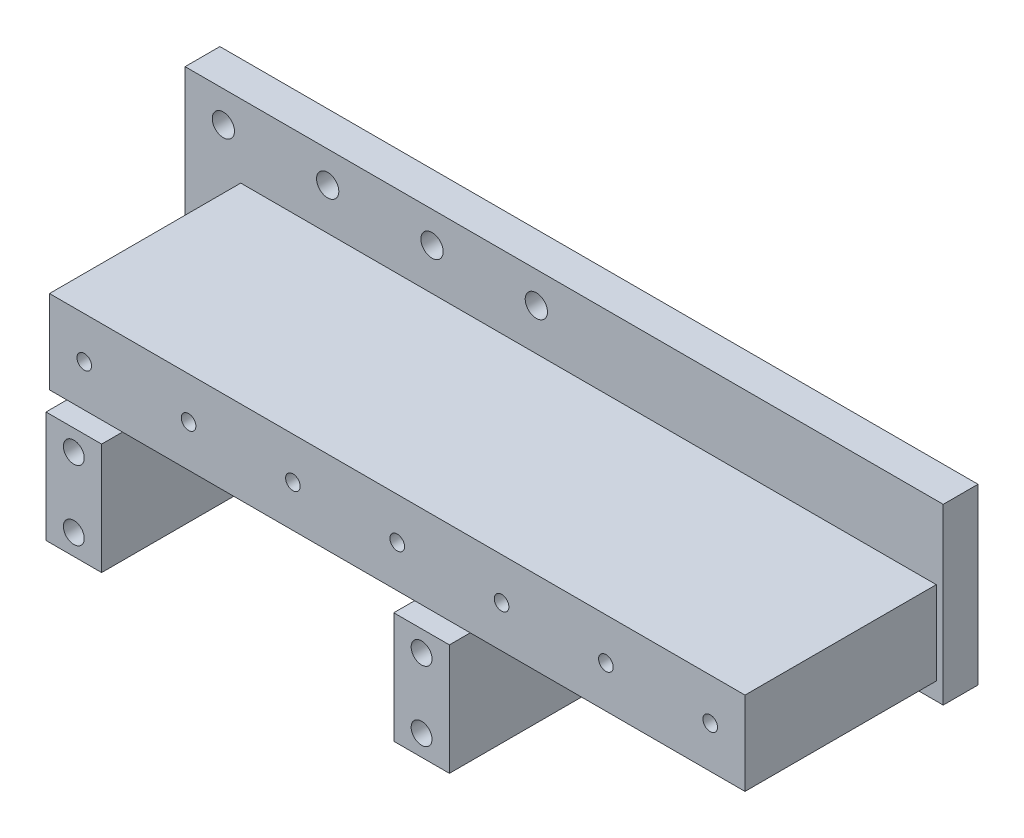
from build123d import *

# Parameters (mm, degrees)
BASE_START                = -5
BASE_PLATE_DEPTH          = 5
MOUNTING_START            = -5.1
MOUNTING_HOLES_PROFILE_R  = 1.6
MOUNTING_HOLES_DEPTH      = 5.3
RAIL_SUPPORT_PROFILE_W    = 100
RAIL_SUPPORT_PROFILE_H    = 12
RAIL_SUPPORT_DEPTH        = 27.5
RAIL_START                = 21
RAIL_FASTENERS_PROFILE_R  = 1.05
RAIL_FASTENERS_DEPTH      = 6.6
SERVO_SUPPORTS_PROFILE_W  = 8
SERVO_SUPPORTS_PROFILE_H  = 16
SERVO_SUPPORTS_DEPTH      = 26
SERVO_START               = 18
SERVO_FASTENERS_PROFILE_R = 1.5
SERVO_FASTENERS_DEPTH     = 8.1


with BuildPart() as part:
    # Base plate profile → Base plate (new body)
    with BuildSketch(Plane.XY.offset(BASE_START)):
        Polygon((-25, -15), (41, -15), (41, 10), (84, 10), (84, 35), (10, 35), (-10, 35), (-25, 35), align=None)
    extrude(amount=BASE_PLATE_DEPTH)

    # Mounting holes profile → Mounting holes (cut)
    with BuildSketch(Plane.XY.offset(MOUNTING_START)):
        with Locations((-19.5, -10.5)):
            Circle(MOUNTING_HOLES_PROFILE_R)
        with Locations((-19.5, 30.5)):
            Circle(MOUNTING_HOLES_PROFILE_R)
        with Locations((25.5, -10.5)):
            Circle(MOUNTING_HOLES_PROFILE_R)
        with Locations((25.5, 30.5)):
            Circle(MOUNTING_HOLES_PROFILE_R)
        with Locations((-4.5, 30.5)):
            Circle(MOUNTING_HOLES_PROFILE_R)
        with Locations((10.5, 30.5)):
            Circle(MOUNTING_HOLES_PROFILE_R)
    extrude(amount=MOUNTING_HOLES_DEPTH, mode=Mode.SUBTRACT)

    # Rail support profile → Rail support (add)
    with BuildSketch(Plane.XY):
        with Locations((33, 18.5)):
            Rectangle(RAIL_SUPPORT_PROFILE_W, RAIL_SUPPORT_PROFILE_H)
    extrude(amount=RAIL_SUPPORT_DEPTH)

    # Rail fasteners profile → Rail fasteners (cut)
    with BuildSketch(Plane.XY.offset(RAIL_START)):
        with Locations((-12, 18.5)):
            Circle(RAIL_FASTENERS_PROFILE_R)
        with Locations((3, 18.5)):
            Circle(RAIL_FASTENERS_PROFILE_R)
        with Locations((18, 18.5)):
            Circle(RAIL_FASTENERS_PROFILE_R)
        with Locations((33, 18.5)):
            Circle(RAIL_FASTENERS_PROFILE_R)
        with Locations((48, 18.5)):
            Circle(RAIL_FASTENERS_PROFILE_R)
        with Locations((63, 18.5)):
            Circle(RAIL_FASTENERS_PROFILE_R)
        with Locations((78, 18.5)):
            Circle(RAIL_FASTENERS_PROFILE_R)
    extrude(amount=RAIL_FASTENERS_DEPTH, mode=Mode.SUBTRACT)

    # Servo supports profile → Servo supports (add)
    with BuildSketch(Plane.XY):
        with Locations((-15, 0)):
            Rectangle(SERVO_SUPPORTS_PROFILE_W, SERVO_SUPPORTS_PROFILE_H)
        with Locations((35, 0)):
            Rectangle(SERVO_SUPPORTS_PROFILE_W, SERVO_SUPPORTS_PROFILE_H)
    extrude(amount=SERVO_SUPPORTS_DEPTH)

    # Servo fasteners profile → Servo fasteners (cut)
    with BuildSketch(Plane.XY.offset(SERVO_START)):
        with Locations((-15, -5)):
            Circle(SERVO_FASTENERS_PROFILE_R)
        with Locations((-15, 5)):
            Circle(SERVO_FASTENERS_PROFILE_R)
        with Locations((35, -5)):
            Circle(SERVO_FASTENERS_PROFILE_R)
        with Locations((35, 5)):
            Circle(SERVO_FASTENERS_PROFILE_R)
    extrude(amount=SERVO_FASTENERS_DEPTH, mode=Mode.SUBTRACT)


solid = part.part
